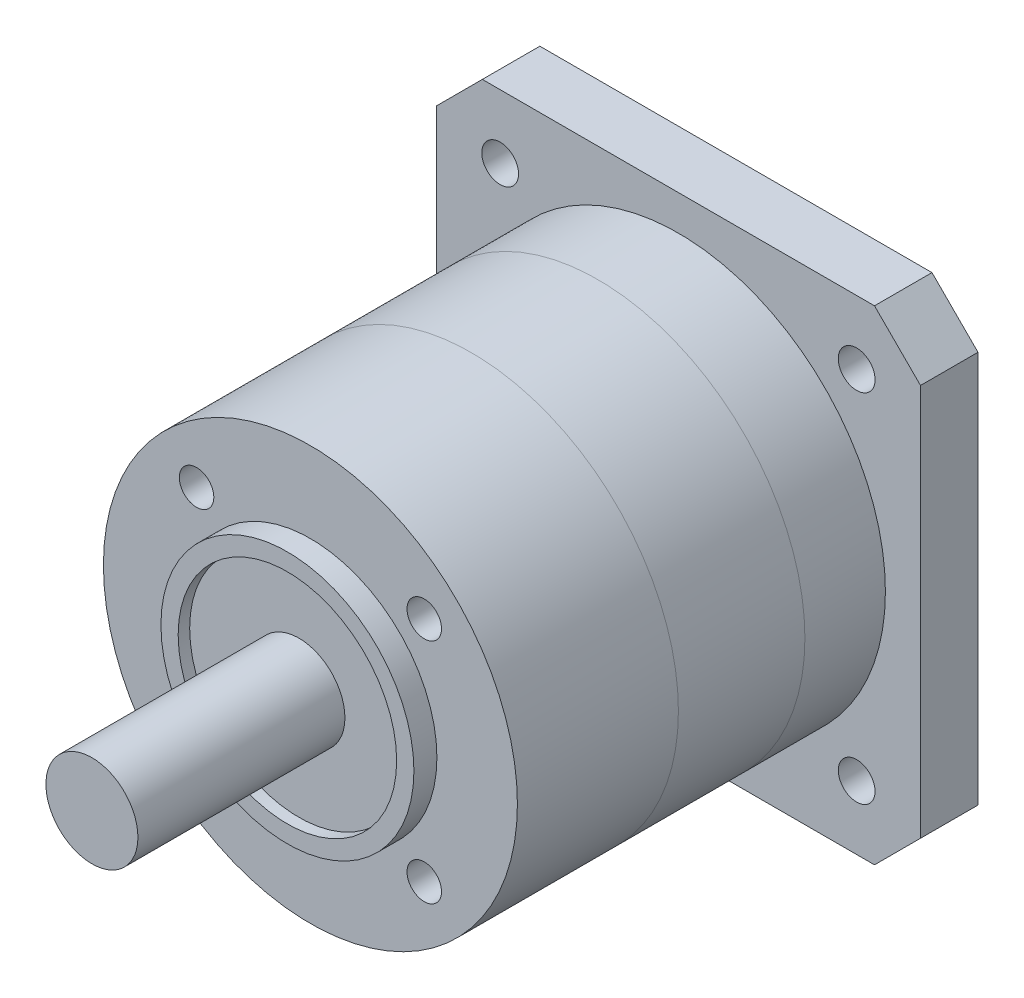
from build123d import *

# Parameters (mm, degrees)
SKETCH1_W           = 42.1
SKETCH1_H           = 42.1
BOSS_EXTRUDE2_DEPTH = 5
SKETCH3_R           = 18
BOSS_EXTRUDE3_DEPTH = 7
SKETCH4_R           = 18
BOSS_EXTRUDE4_DEPTH = 11
SKETCH5_R           = 18
BOSS_EXTRUDE5_DEPTH = 14
SKETCH6_R           = 11
BOSS_EXTRUDE6_DEPTH = 2
SKETCH9_R           = 9.5
CUT_EXTRUDE2_DEPTH  = 1
SKETCH7_R           = 4
BOSS_EXTRUDE7_DEPTH = 19
SKETCH10_R          = 1.6
CUT_EXTRUDE3_DEPTH  = 5
SKETCH12_R          = 1.5
CUT_EXTRUDE5_DEPTH  = 10
CHAMFER1_SIZE       = 4
SKETCH15_R          = 11
CUT_EXTRUDE8_DEPTH  = 1.5


with BuildPart() as part:
    # Sketch1 → Boss-Extrude2 (new body)
    with BuildSketch(Plane.XY):
        Rectangle(SKETCH1_W, SKETCH1_H)
    extrude(amount=BOSS_EXTRUDE2_DEPTH)

    # Sketch3 → Boss-Extrude3 (add)
    with BuildSketch(Plane.XY.offset(5)):
        Circle(SKETCH3_R)
    extrude(amount=BOSS_EXTRUDE3_DEPTH)

    # Sketch10 → Cut-Extrude3 (cut)
    with BuildSketch(Plane(origin=(0, 0, 0), x_dir=(-1, 0, 0), z_dir=(0, 0, -1))):
        with Locations((-15.5, 15.5)):
            Circle(SKETCH10_R)
        with Locations((15.5, 15.5)):
            Circle(SKETCH10_R)
        with Locations((15.5, -15.5)):
            Circle(SKETCH10_R)
        with Locations((-15.5, -15.5)):
            Circle(SKETCH10_R)
    extrude(amount=-CUT_EXTRUDE3_DEPTH, mode=Mode.SUBTRACT)

    # Chamfer1
    chamfer1_edges = [part.edges().sort_by_distance(p)[0] for p in [
        (-21.05, 21.05, 2.5),
        (21.05, 21.05, 2.5),
        (21.05, -21.05, 2.5),
        (-21.05, -21.05, 2.5),
    ]]
    chamfer(chamfer1_edges, length=CHAMFER1_SIZE)

    # Sketch15 → Cut-Extrude8 (cut)
    with BuildSketch(Plane(origin=(0, 0, 0), x_dir=(-1, 0, 0), z_dir=(0, 0, -1))):
        with Locations(Location((0, 0, 0), (0, 0, 180))):
            Circle(SKETCH15_R)
    extrude(amount=-CUT_EXTRUDE8_DEPTH, mode=Mode.SUBTRACT)


with BuildPart() as body_2:
    # Sketch4 → Boss-Extrude4 (new body)
    with BuildSketch(Plane.XY.offset(12)):
        Circle(SKETCH4_R)
    extrude(amount=BOSS_EXTRUDE4_DEPTH)


with BuildPart() as body_3:
    # Sketch5 → Boss-Extrude5 (new body)
    with BuildSketch(Plane.XY.offset(23)):
        Circle(SKETCH5_R)
    extrude(amount=BOSS_EXTRUDE5_DEPTH)

    # Sketch6 → Boss-Extrude6 (add)
    with BuildSketch(Plane.XY.offset(37)):
        Circle(SKETCH6_R)
    extrude(amount=BOSS_EXTRUDE6_DEPTH)

    # Sketch9 → Cut-Extrude2 (cut)
    with BuildSketch(Plane.XY.offset(39)):
        Circle(SKETCH9_R)
    extrude(amount=-CUT_EXTRUDE2_DEPTH, mode=Mode.SUBTRACT)

    # Sketch12 → Cut-Extrude5 (cut)
    with BuildSketch(Plane.XY.offset(37)):
        with Locations((-9.899494937, 9.899494937)):
            Circle(SKETCH12_R)
        with Locations((9.899494937, 9.899494937)):
            Circle(SKETCH12_R)
        with Locations((9.899494937, -9.899494937)):
            Circle(SKETCH12_R)
        with Locations((-9.899494937, -9.899494937)):
            Circle(SKETCH12_R)
    extrude(amount=-CUT_EXTRUDE5_DEPTH, mode=Mode.SUBTRACT)


with BuildPart() as body_4:
    # Sketch7 → Boss-Extrude7 (new body)
    with BuildSketch(Plane.XY.offset(37)):
        Circle(SKETCH7_R)
    extrude(amount=BOSS_EXTRUDE7_DEPTH)


solid = Compound([part.part, body_2.part, body_3.part, body_4.part])
